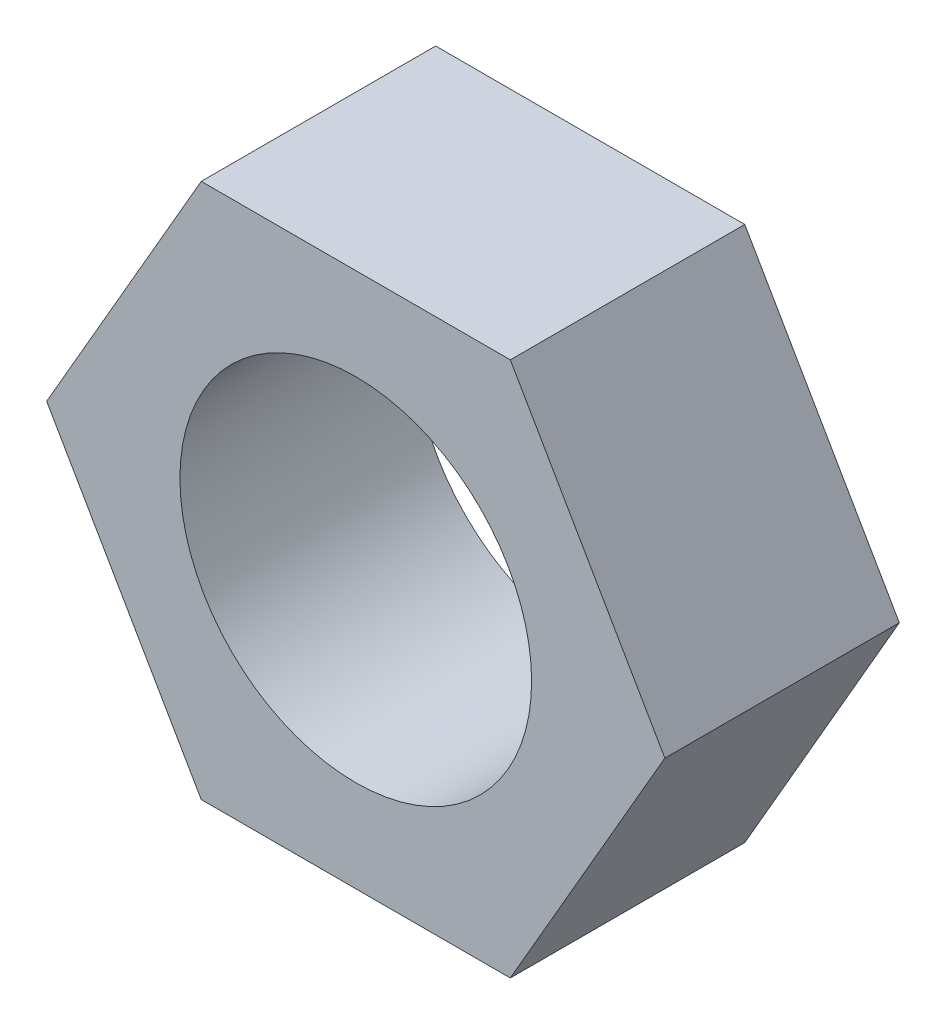
from build123d import *

# Parameters (mm, degrees)
EXTRUDE_1_DEPTH        = 3
HOLE_WIZARD_M4_1_D     = 4.5
HOLE_WIZARD_M4_1_DEPTH = 20
HOLE_WIZARD_M4_1_TIP   = 1.351936393


with BuildPart() as part:
    # ｽｹｯﾁ1 → ﾎﾞｽ - 押し出し1 (new body)
    with BuildSketch(Plane.XY):
        Polygon((3.954849344, 0), (1.977424672, 3.425), (-1.977424672, 3.425), (-3.954849344, 0), (-1.977424672, -3.425), (1.977424672, -3.425), align=None)
    extrude(amount=EXTRUDE_1_DEPTH)

    # M4 すきま穴1
    with Locations(Plane.XY.offset(3)):
        with Locations((0, 0)):
            Hole(HOLE_WIZARD_M4_1_D / 2, depth=HOLE_WIZARD_M4_1_DEPTH)
            with Locations((0, 0, -(HOLE_WIZARD_M4_1_DEPTH + HOLE_WIZARD_M4_1_TIP / 2))):  # 118° drill point
                Cone(0, HOLE_WIZARD_M4_1_D / 2, HOLE_WIZARD_M4_1_TIP, mode=Mode.SUBTRACT)


solid = part.part
